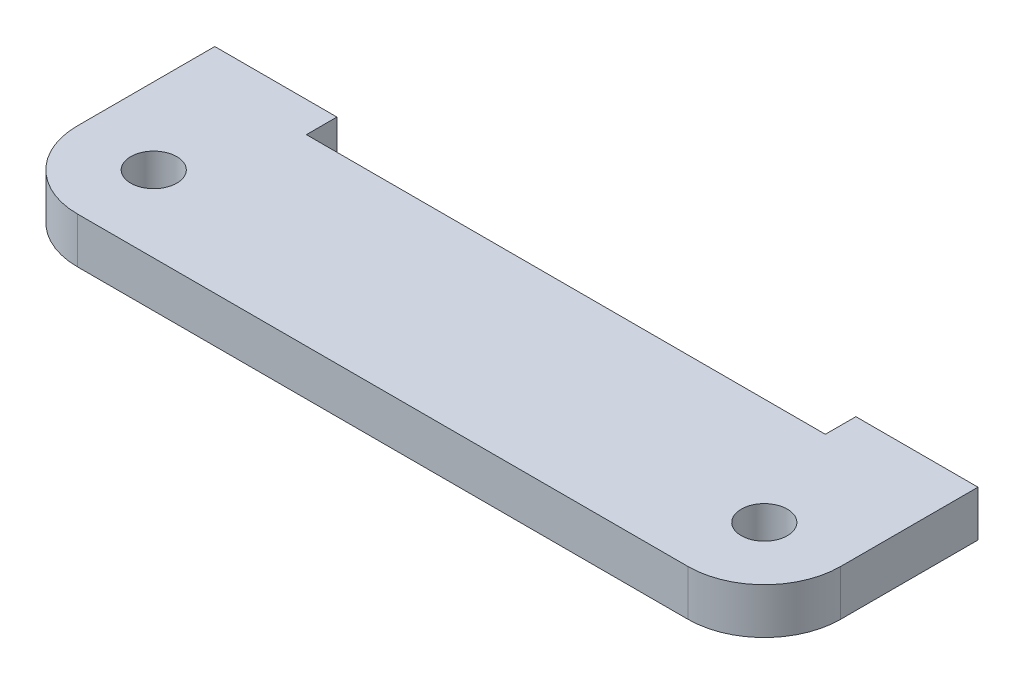
from build123d import *

# Parameters (mm, degrees)
BOSS_EXTRUDE1_DEPTH  = 3
M3_CLEARANCE_HOLE1_D = 3.02
FILLET1_R            = 5


with BuildPart() as part:
    # Sketch1 → Boss-Extrude1 (new body)
    with BuildSketch(Plane(origin=(0, 0, 0), x_dir=(1, 0, 0), z_dir=(0, 1, 0))):
        Polygon((-17, 12), (17, 12), (17, 14), (25, 14), (25, 0), (-25, 0), (-25, 14), (-17, 14), align=None)
    extrude(amount=BOSS_EXTRUDE1_DEPTH)

    # M3 Clearance Hole1 (through all)
    with Locations(Plane(origin=(0, 3, 0), x_dir=(1, 0, 0), z_dir=(0, 1, 0))):
        with Locations((20, 5), (-20, 5)):
            Hole(M3_CLEARANCE_HOLE1_D / 2)

    # Fillet1
    fillet1_edges = [part.edges().sort_by_distance(p)[0] for p in [
        (25, 1.5, 0),
        (-25, 1.5, 0),
    ]]
    fillet(fillet1_edges, radius=FILLET1_R)


solid = part.part
